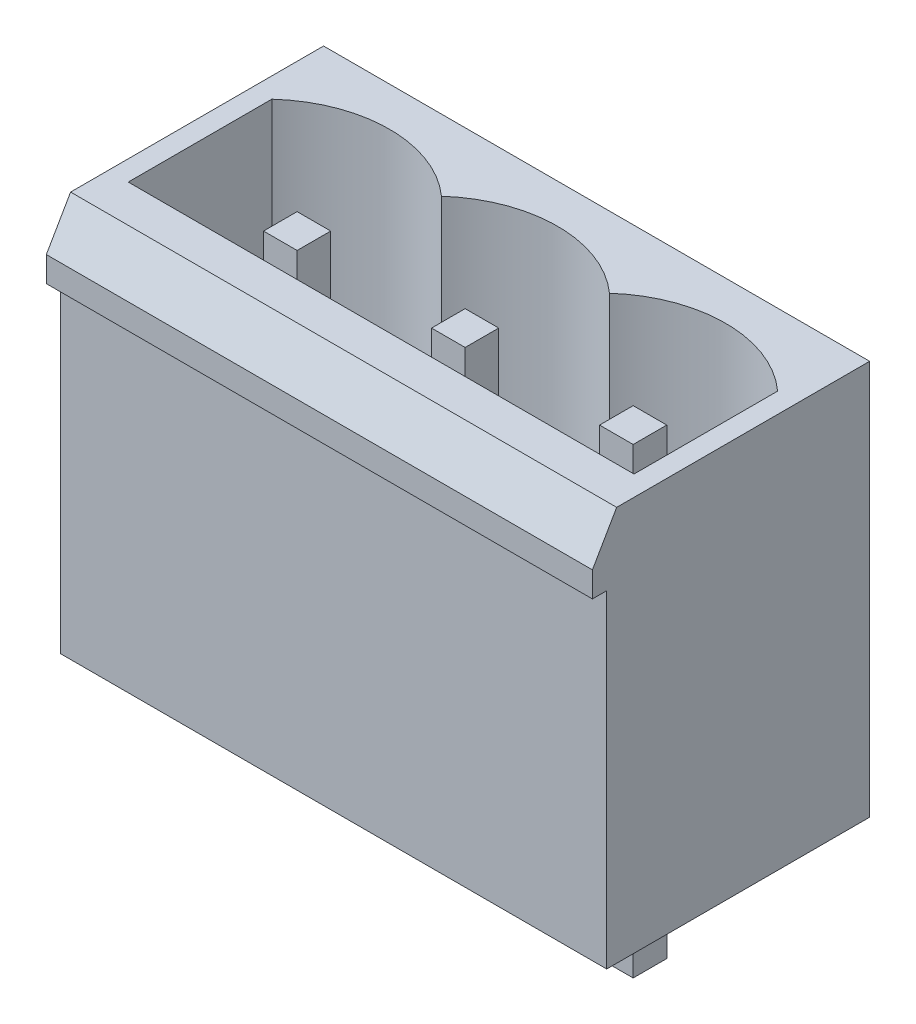
from build123d import *

# Parameters (mm, degrees)
EXTRUDE1_DEPTH     = 16.51
CUT_EXTRUDE1_DEPTH = 10.16
EXTRUDE2_START     = -3.302
SKETCH2_W          = 1.016
SKETCH2_H          = 1.016
EXTRUDE2_DEPTH     = 13.97
LPATTERN1_COUNT    = 3
LPATTERN1_PITCH    = 5.08


with BuildPart() as part:
    # Sketch1 → Extrude1 (new body)
    with BuildSketch(Plane(origin=(3.175, 0, 0), x_dir=(0, 0, -1), z_dir=(1, 0, 0))):
        Polygon((-3.9751, 0), (-3.9751, 9.906), (-4.4069, 9.906), (-4.4069, 10.668), (-3.673665158, 11.938), (3.9751, 11.938), (3.9751, 0), align=None)
    extrude(amount=-EXTRUDE1_DEPTH)

    # Sketch3 → Cut-Extrude1 (cut)
    with BuildSketch(Plane(origin=(0, 11.938, 0), x_dir=(1, 0, 0), z_dir=(0, 1, 0))):
        with BuildLine():
            Line((-2.5654, 1.800881758), (-2.5654, -2.54))
            Line((-2.5654, -2.54), (2.5654, -2.54))
            Line((2.5654, -2.54), (2.5654, 1.800881758))
            ThreePointArc((2.5654, 1.800881758), (0, 2.794), (-2.5654, 1.800881758))
        make_face()
    cut_extrude1 = extrude(amount=-CUT_EXTRUDE1_DEPTH, mode=Mode.SUBTRACT)

    # Sketch2 → Extrude2 (add)
    with BuildSketch(Plane(origin=(0, 0, 0), x_dir=(1, 0, 0), z_dir=(0, 1, 0)).offset(EXTRUDE2_START)):
        Rectangle(SKETCH2_W, SKETCH2_H)
    extrude2 = extrude(amount=EXTRUDE2_DEPTH)

    # LPattern1: Cut-Extrude1, Extrude2 ×3
    with Locations(*[(-i * LPATTERN1_PITCH, 0, 0) for i in range(1, LPATTERN1_COUNT)]):
        add(cut_extrude1, mode=Mode.SUBTRACT)
        add(extrude2)


solid = part.part
